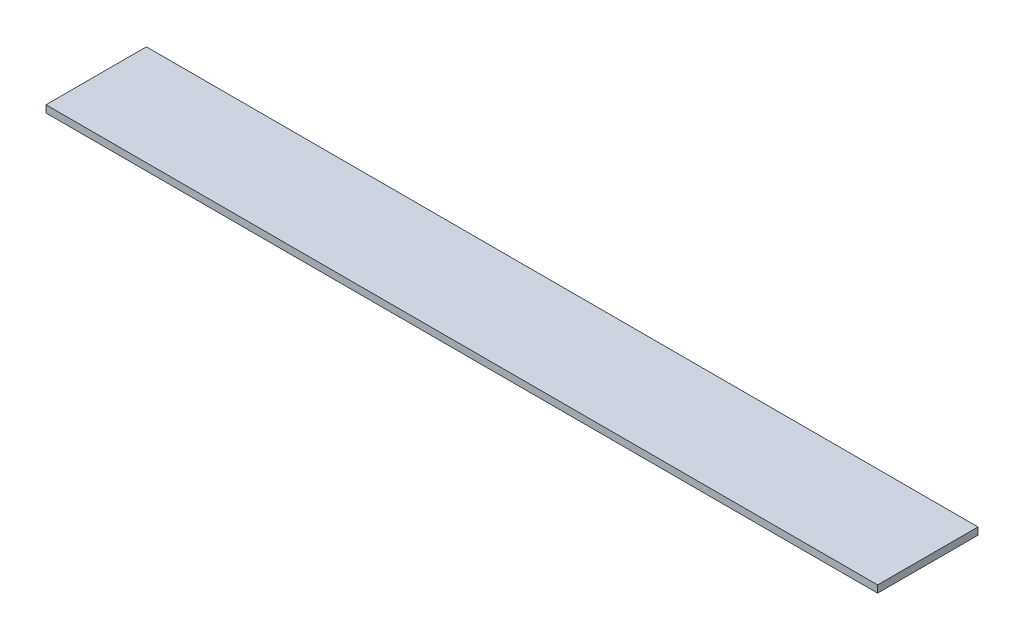
from build123d import *

# Parameters (mm, degrees)
SKETCH1_W           = 580
SKETCH1_H           = 70
BOSS_EXTRUDE1_DEPTH = 5


with BuildPart() as part:
    # Sketch1 → Boss-Extrude1 (new body)
    with BuildSketch(Plane(origin=(0, 0, 0), x_dir=(1, 0, 0), z_dir=(0, 1, 0))):
        Rectangle(SKETCH1_W, SKETCH1_H)
    extrude(amount=BOSS_EXTRUDE1_DEPTH)


solid = part.part
